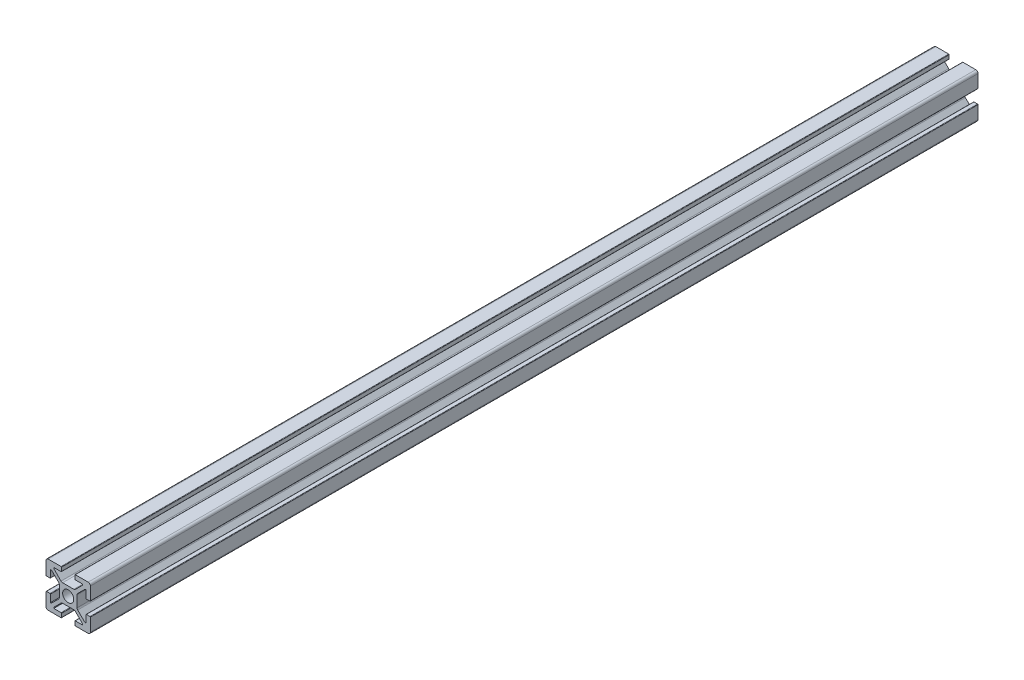
from build123d import *

# Parameters (mm, degrees)
SKETCH1_R           = 2.5
BOSS_EXTRUDE1_DEPTH = 400


with BuildPart() as part:
    # Sketch1 → Boss-Extrude1 (new body)
    with BuildSketch(Plane.XY):
        with BuildLine():
            Line((0.2, 13), (1.8, 13))
            ThreePointArc((1.8, 13), (1.941421356, 13.058578644), (2, 13.2))
            Line((2, 13.2), (2, 16.5))
            Line((2, 16.5), (2.439339828, 16.5))
            Line((2.439339828, 16.5), (5.707106781, 13.232233047))
            ThreePointArc((5.707106781, 13.232233047), (5.923879533, 12.907809698), (6, 12.525126266))
            Line((6, 12.525126266), (6, 7.474873734))
            ThreePointArc((6, 7.474873734), (5.923879533, 7.092190302), (5.707106781, 6.767766953))
            Line((5.707106781, 6.767766953), (2.439339828, 3.5))
            Line((2.439339828, 3.5), (2, 3.5))
            Line((2, 3.5), (2, 6.8))
            ThreePointArc((2, 6.8), (1.941421356, 6.941421356), (1.8, 7))
            Line((1.8, 7), (0.2, 7))
            ThreePointArc((0.2, 7), (0.058578644, 6.941421356), (0, 6.8))
            Line((0, 6.8), (0, 1))
            ThreePointArc((0, 1), (0.292893219, 0.292893219), (1, 0))
            Line((1, 0), (6.8, 0))
            ThreePointArc((6.8, 0), (6.941421356, 0.058578644), (7, 0.2))
            Line((7, 0.2), (7, 1.8))
            ThreePointArc((7, 1.8), (6.941421356, 1.941421356), (6.8, 2))
            Line((6.8, 2), (3.5, 2))
            Line((3.5, 2), (3.5, 2.439339828))
            Line((3.5, 2.439339828), (6.767766953, 5.707106781))
            ThreePointArc((6.767766953, 5.707106781), (7.092190302, 5.923879533), (7.474873734, 6))
            Line((7.474873734, 6), (10, 6))
            Line((10, 6), (12.525126266, 6))
            ThreePointArc((12.525126266, 6), (12.907809698, 5.923879533), (13.232233047, 5.707106781))
            Line((13.232233047, 5.707106781), (16.5, 2.439339828))
            Line((16.5, 2.439339828), (16.5, 2))
            Line((16.5, 2), (13.2, 2))
            ThreePointArc((13.2, 2), (13.058578644, 1.941421356), (13, 1.8))
            Line((13, 1.8), (13, 0.2))
            ThreePointArc((13, 0.2), (13.058578644, 0.058578644), (13.2, 0))
            Line((13.2, 0), (19, 0))
            ThreePointArc((19, 0), (19.707106781, 0.292893219), (20, 1))
            Line((20, 1), (20, 6.8))
            ThreePointArc((20, 6.8), (19.941421356, 6.941421356), (19.8, 7))
            Line((19.8, 7), (18.2, 7))
            ThreePointArc((18.2, 7), (18.058578644, 6.941421356), (18, 6.8))
            Line((18, 6.8), (18, 3.5))
            Line((18, 3.5), (17.560660172, 3.5))
            Line((17.560660172, 3.5), (14.292893219, 6.767766953))
            ThreePointArc((14.292893219, 6.767766953), (14.076120467, 7.092190302), (14, 7.474873734))
            Line((14, 7.474873734), (14, 12.525126266))
            ThreePointArc((14, 12.525126266), (14.076120467, 12.907809698), (14.292893219, 13.232233047))
            Line((14.292893219, 13.232233047), (17.560660172, 16.5))
            Line((17.560660172, 16.5), (18, 16.5))
            Line((18, 16.5), (18, 13.2))
            ThreePointArc((18, 13.2), (18.058578644, 13.058578644), (18.2, 13))
            Line((18.2, 13), (19.8, 13))
            ThreePointArc((19.8, 13), (19.941421356, 13.058578644), (20, 13.2))
            Line((20, 13.2), (20, 19))
            ThreePointArc((20, 19), (19.707106781, 19.707106781), (19, 20))
            Line((19, 20), (13.2, 20))
            ThreePointArc((13.2, 20), (13.058578644, 19.941421356), (13, 19.8))
            Line((13, 19.8), (13, 18.2))
            ThreePointArc((13, 18.2), (13.058578644, 18.058578644), (13.2, 18))
            Line((13.2, 18), (16.5, 18))
            Line((16.5, 18), (16.5, 17.560660172))
            Line((16.5, 17.560660172), (13.232233047, 14.292893219))
            ThreePointArc((13.232233047, 14.292893219), (12.907809698, 14.076120467), (12.525126266, 14))
            Line((12.525126266, 14), (10, 14))
            Line((10, 14), (7.474873734, 14))
            ThreePointArc((7.474873734, 14), (7.092190302, 14.076120467), (6.767766953, 14.292893219))
            Line((6.767766953, 14.292893219), (3.5, 17.560660172))
            Line((3.5, 17.560660172), (3.5, 18))
            Line((3.5, 18), (6.8, 18))
            ThreePointArc((6.8, 18), (6.941421356, 18.058578644), (7, 18.2))
            Line((7, 18.2), (7, 19.8))
            ThreePointArc((7, 19.8), (6.941421356, 19.941421356), (6.8, 20))
            Line((6.8, 20), (1, 20))
            ThreePointArc((1, 20), (0.292893219, 19.707106781), (0, 19))
            Line((0, 19), (0, 13.2))
            ThreePointArc((0, 13.2), (0.058578644, 13.058578644), (0.2, 13))
        make_face()
        with Locations((10, 10)):
            Circle(SKETCH1_R, mode=Mode.SUBTRACT)
    extrude(amount=BOSS_EXTRUDE1_DEPTH)


solid = part.part
